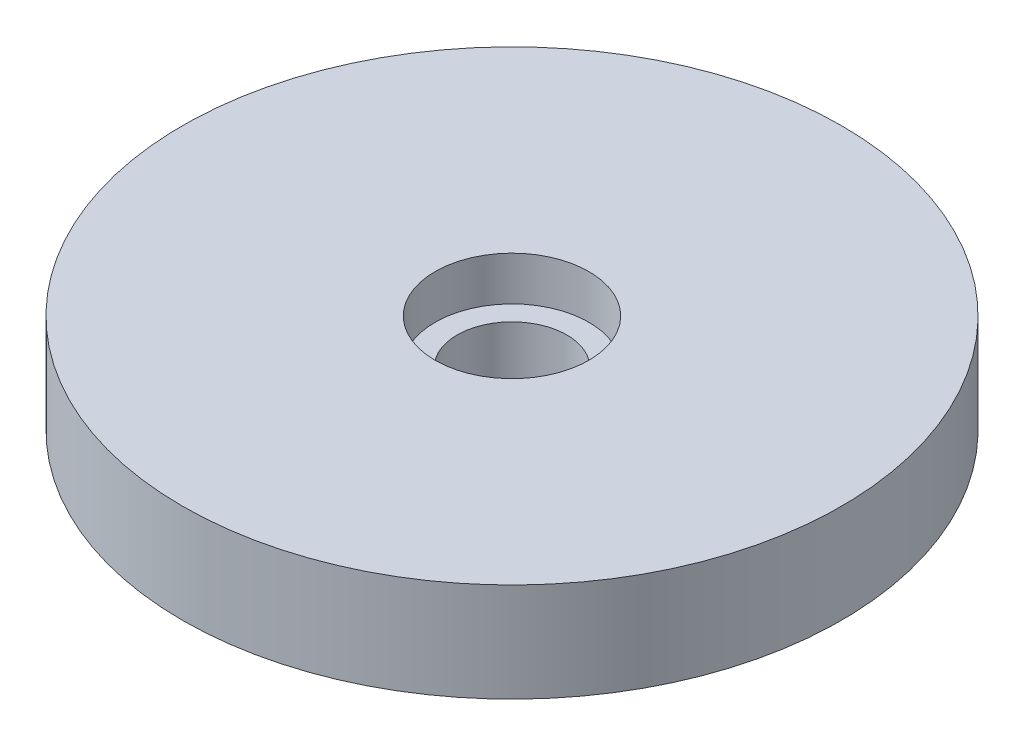
from build123d import *

# Parameters (mm, degrees)
SKETCH1_R           = 38.1
SKETCH1_R_2         = 25.4
BOSS_EXTRUDE3_DEPTH = 6.35
SKETCH1_3_R         = 25.4
BOSS_EXTRUDE4_DEPTH = 6.35
SKETCH2_R           = 3.81
CUT_EXTRUDE1_DEPTH  = 2.54
SKETCH3_R           = 6.35
CUT_EXTRUDE2_DEPTH  = 55.254423783
SKETCH4_R           = 38.1
SKETCH4_R_2         = 8.89
BOSS_EXTRUDE5_DEPTH = 5.08


with BuildPart() as part:
    # Sketch1 → Boss-Extrude3 (new body)
    with BuildSketch(Plane(origin=(0, 0, 0), x_dir=(1, 0, 0), z_dir=(0, 1, 0))):
        Circle(SKETCH1_R)
        Circle(SKETCH1_R_2, mode=Mode.SUBTRACT)
    extrude(amount=BOSS_EXTRUDE3_DEPTH)

    # Sketch1<3> → Boss-Extrude4 (add)
    with BuildSketch(Plane(origin=(0, 0, 0), x_dir=(1, 0, 0), z_dir=(0, 1, 0))):
        Circle(SKETCH1_3_R)
    extrude(amount=BOSS_EXTRUDE4_DEPTH)

    # Sketch2 → Cut-Extrude1 (cut)
    with BuildSketch(Plane.XZ):
        with Locations((0, 31.266403726)):
            Circle(SKETCH2_R)
        with Locations((26.954852036, 15.704012647)):
            Circle(SKETCH2_R)
        with Locations((26.954852036, -15.420769511)):
            Circle(SKETCH2_R)
        with Locations((0, -30.98316059)):
            Circle(SKETCH2_R)
        with Locations((-26.954852036, -15.420769511)):
            Circle(SKETCH2_R)
        with Locations((-26.954852036, 15.704012647)):
            Circle(SKETCH2_R)
    extrude(amount=-CUT_EXTRUDE1_DEPTH, mode=Mode.SUBTRACT)

    # Sketch3 → Cut-Extrude2 (cut, through all)
    with BuildSketch(Plane(origin=(0, 6.35, 0), x_dir=(1, 0, 0), z_dir=(0, 1, 0))):
        Circle(SKETCH3_R)
    extrude(amount=-CUT_EXTRUDE2_DEPTH, mode=Mode.SUBTRACT)

    # Sketch4 → Boss-Extrude5 (add)
    with BuildSketch(Plane(origin=(0, 6.35, 0), x_dir=(1, 0, 0), z_dir=(0, 1, 0))):
        Circle(SKETCH4_R)
        Circle(SKETCH4_R_2, mode=Mode.SUBTRACT)
    extrude(amount=BOSS_EXTRUDE5_DEPTH)


solid = part.part
